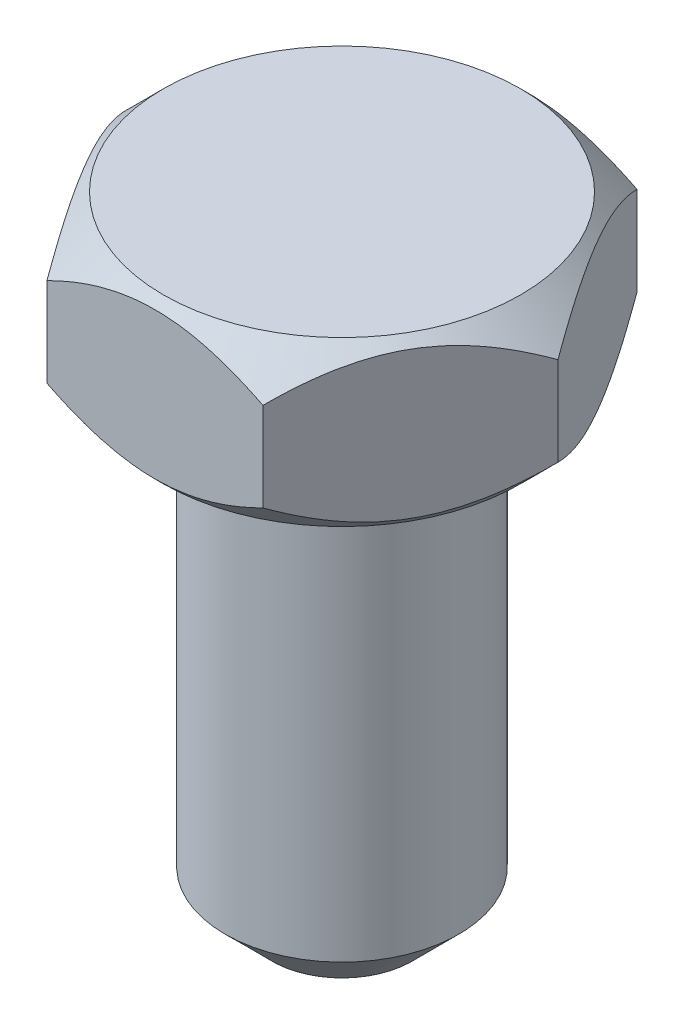
from build123d import *

# Parameters (mm, degrees)
EXTRUDE_1_DEPTH = 3.5
SKETCH_5_R      = 2.5
EXTRUDE_2_DEPTH = 10
CHAMFER_1_SIZE  = 1


with BuildPart() as part:
    # Эскиз1 → Вытянуть1 (new body)
    with BuildSketch(Plane(origin=(0, 0, 0), x_dir=(1, 0, 0), z_dir=(0, 1, 0))):
        Polygon((-2.309401077, 4), (2.309401077, 4), (4.618802154, 0), (2.309401077, -4), (-2.309401077, -4), (-4.618802154, 0), align=None)
    extrude(amount=-EXTRUDE_1_DEPTH)

    # Эскиз5 → Вытянуть2 (add)
    with BuildSketch(Plane.XZ.offset(3.5)):
        with Locations(Location((0, 0, 0), (0, 0, 90))):
            Circle(SKETCH_5_R)
    extrude(amount=EXTRUDE_2_DEPTH)

    # Фаска1
    chamfer_1_edges = [part.edges().sort_by_distance(p)[0] for p in [
        (0, -13.5, -2.5),
    ]]
    chamfer(chamfer_1_edges, length=CHAMFER_1_SIZE)

    # Эскиз4 → Вырез-Повернуть1 (revolve, cut)
    with BuildSketch(Plane.XY, mode=Mode.PRIVATE) as cut_revolve_1_sk:
        Polygon((-4.618802154, -0.8), (-3.818802154, 0), (-4.618802154, 0), align=None)
        Polygon((-4.618802154, -2.7), (-3.818802154, -3.5), (-4.618802154, -3.5), align=None)
    revolve(cut_revolve_1_sk.sketch.rotate(Axis((0, -3.5, 0), (0, -1, 0)), 120.000000119), axis=Axis((0, -3.5, 0), (0, -1, 0)), mode=Mode.SUBTRACT)


solid = part.part
